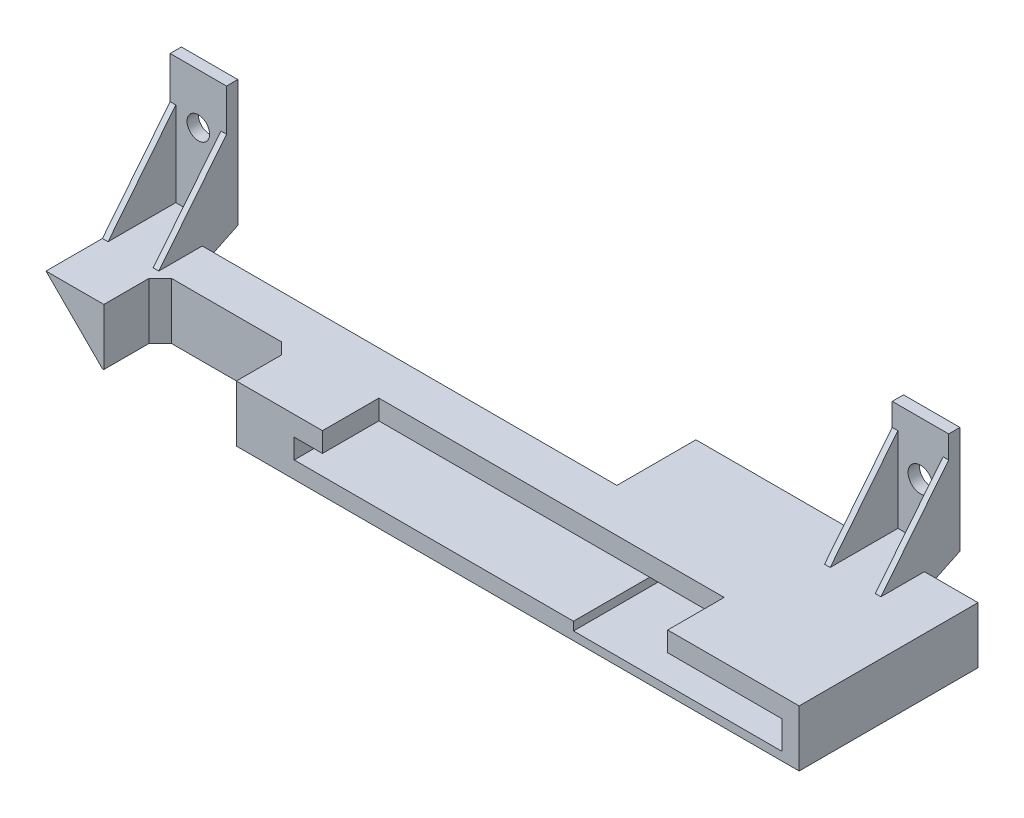
from build123d import *

# Parameters (mm, degrees)
SKETCH1_W            = 10
SKETCH1_H            = 50
SKETCH1_W_2          = 4
SKETCH1_H_2          = 30
BOSS_EXTRUDE1_DEPTH  = 2
SKETCH2_W            = 50
SKETCH2_H            = 10
SKETCH2_W_2          = 37
SKETCH2_H_2          = 5
BOSS_EXTRUDE2_DEPTH  = 12
SKETCH6_W            = 133.5
SKETCH6_H            = 10
SKETCH6_W_2          = 37
SKETCH6_H_2          = 5
BOSS_EXTRUDE7_DEPTH  = 2
SKETCH3_W            = 133.5
SKETCH3_H            = 10
BOSS_EXTRUDE3_DEPTH  = 5.7
SKETCH4_W            = 10.25
SKETCH4_H            = 10
BOSS_EXTRUDE4_DEPTH  = 10
CHAMFER1_SIZE        = 2
BOSS_EXTRUDE5_START  = -38
SKETCH5_W            = 10
SKETCH5_H            = 19
SKETCH5_R            = 2.2
BOSS_EXTRUDE5_DEPTH  = 2
BOSS_EXTRUDE6_START  = -24
SKETCH5_3_W          = 10
SKETCH5_3_H          = 22.4
SKETCH5_3_R          = 2
BOSS_EXTRUDE6_DEPTH  = 2
BOSS_EXTRUDE8_DEPTH  = 1
BOSS_EXTRUDE9_START  = -10
BOSS_EXTRUDE9_DEPTH  = 1
BOSS_EXTRUDE10_DEPTH = 1
BOSS_EXTRUDE11_START = -10
BOSS_EXTRUDE11_DEPTH = 1
BOSS_EXTRUDE12_START = -9.5
BOSS_EXTRUDE12_DEPTH = 10
BOSS_EXTRUDE13_DEPTH = 10
CHAMFER2_SIZE        = 10


with BuildPart() as part:
    # Sketch1 → Boss-Extrude1 (new body)
    with BuildSketch(Plane(origin=(0, 0, 0), x_dir=(0, 1, 0), z_dir=(0, 0, 1))):
        Rectangle(SKETCH1_W, SKETCH1_H)
        with Locations((-0.5, -3)):
            Rectangle(SKETCH1_W_2, SKETCH1_H_2, mode=Mode.SUBTRACT)
    extrude(amount=BOSS_EXTRUDE1_DEPTH)

    # Sketch2 → Boss-Extrude2 (add)
    with BuildSketch(Plane.XY.offset(2)):
        Rectangle(SKETCH2_W, SKETCH2_H)
        with Locations((3.5, -1)):
            Rectangle(SKETCH2_W_2, SKETCH2_H_2, mode=Mode.SUBTRACT)
    extrude(amount=BOSS_EXTRUDE2_DEPTH)

    # Sketch6 → Boss-Extrude7 (add)
    with BuildSketch(Plane.XY.offset(14)):
        with Locations((-41.75, 0)):
            Rectangle(SKETCH6_W, SKETCH6_H)
        with Locations((3.5, -1)):
            Rectangle(SKETCH6_W_2, SKETCH6_H_2, mode=Mode.SUBTRACT)
    extrude(amount=BOSS_EXTRUDE7_DEPTH)

    # Sketch3 → Boss-Extrude3 (add)
    with BuildSketch(Plane.XY.offset(16)):
        with Locations((-41.75, 0)):
            Rectangle(SKETCH3_W, SKETCH3_H)
        Polygon((22, -3.5), (-15, -3.5), (-15, -2), (-64.5, -2), (-64.5, 1.5), (22, 1.5), align=None, mode=Mode.SUBTRACT)
    extrude(amount=BOSS_EXTRUDE3_DEPTH)

    # Sketch4 → Boss-Extrude4 (add)
    with BuildSketch(Plane.XY.offset(21.7)):
        with Locations((-103.375, 0)):
            Rectangle(SKETCH4_W, SKETCH4_H)
        Polygon((-64.5, -2), (-64.5, 1.5), (-59.5, 1.5), (-59.5, 5), (-74.75, 5), (-74.75, -5), (25, -5), (25, 5), (1.7, 5), (1.7, 1.5), (22, 1.5), (22, -3.5), (-15, -3.5), (-15, -2), align=None)
    extrude(amount=BOSS_EXTRUDE4_DEPTH)

    # Chamfer1
    chamfer1_edges = [part.edges().sort_by_distance(p)[0] for p in [
        (-98.25, 0, 21.7),
        (-74.75, 0, 21.7),
    ]]
    chamfer(chamfer1_edges, length=CHAMFER1_SIZE)



with BuildPart() as body_2:
    # Sketch5 → Boss-Extrude5 (new body)
    with BuildSketch(Plane.XY.offset(31.7).offset(BOSS_EXTRUDE5_START)):
        with Locations((10.5, 14.5)):
            Rectangle(SKETCH5_W, SKETCH5_H)
        with Locations((10.5, 14.5)):
            Circle(SKETCH5_R, mode=Mode.SUBTRACT)
    extrude(amount=BOSS_EXTRUDE5_DEPTH)


with BuildPart() as body_3:
    # Sketch5<3> → Boss-Extrude6 (new body)
    with BuildSketch(Plane.XY.offset(31.7).offset(BOSS_EXTRUDE6_START)):
        with Locations((-103.5, 16.2)):
            Rectangle(SKETCH5_3_W, SKETCH5_3_H)
        with Locations((-103.5, 18.5)):
            Circle(SKETCH5_3_R, mode=Mode.SUBTRACT)
    extrude(amount=BOSS_EXTRUDE6_DEPTH)


with BuildPart() as part_1:
    add(part.part)

    add(body_2.part)  # Boss-Extrude8 merges body 2
    # Sketch7 → Boss-Extrude8 (add)
    with BuildSketch(Plane.YZ.offset(15.5)):
        Polygon((5, -4.3), (20, -4.3), (5, 7.7), align=None)
    extrude(amount=-BOSS_EXTRUDE8_DEPTH)

    # Sketch7<2> → Boss-Extrude9 (add)
    with BuildSketch(Plane.YZ.offset(15.5).offset(BOSS_EXTRUDE9_START)):
        Polygon((5, -4.3), (20, -4.3), (5, 7.7), align=None)
    extrude(amount=BOSS_EXTRUDE9_DEPTH)


    add(body_3.part)  # Boss-Extrude10 merges body 3
    # Sketch8 → Boss-Extrude10 (add)
    with BuildSketch(Plane.YZ.offset(-98.5)):
        Polygon((5, 9.7), (20, 9.7), (5, 21.7), align=None)
    extrude(amount=-BOSS_EXTRUDE10_DEPTH)

    # Sketch8<2> → Boss-Extrude11 (add)
    with BuildSketch(Plane.YZ.offset(-98.5).offset(BOSS_EXTRUDE11_START)):
        Polygon((5, 9.7), (20, 9.7), (5, 21.7), align=None)
    extrude(amount=BOSS_EXTRUDE11_DEPTH)

    # Sketch9 → Boss-Extrude12 (add)
    with BuildSketch(Plane.YZ.offset(25).offset(BOSS_EXTRUDE12_START)):
        Polygon((5, -6.3), (2, 0), (5, 0), align=None)
    extrude(amount=-BOSS_EXTRUDE12_DEPTH)

    # Sketch10 → Boss-Extrude13 (add)
    with BuildSketch(Plane.YZ.offset(-98.5)):
        Polygon((5, 7.7), (5, 14), (2, 14), align=None)
    extrude(amount=-BOSS_EXTRUDE13_DEPTH)

    # Chamfer2
    chamfer2_edges = [part_1.edges().sort_by_distance(p)[0] for p in [
        (-108.5, -5, 22.85),
    ]]
    chamfer(chamfer2_edges, length=CHAMFER2_SIZE)


solid = part_1.part
